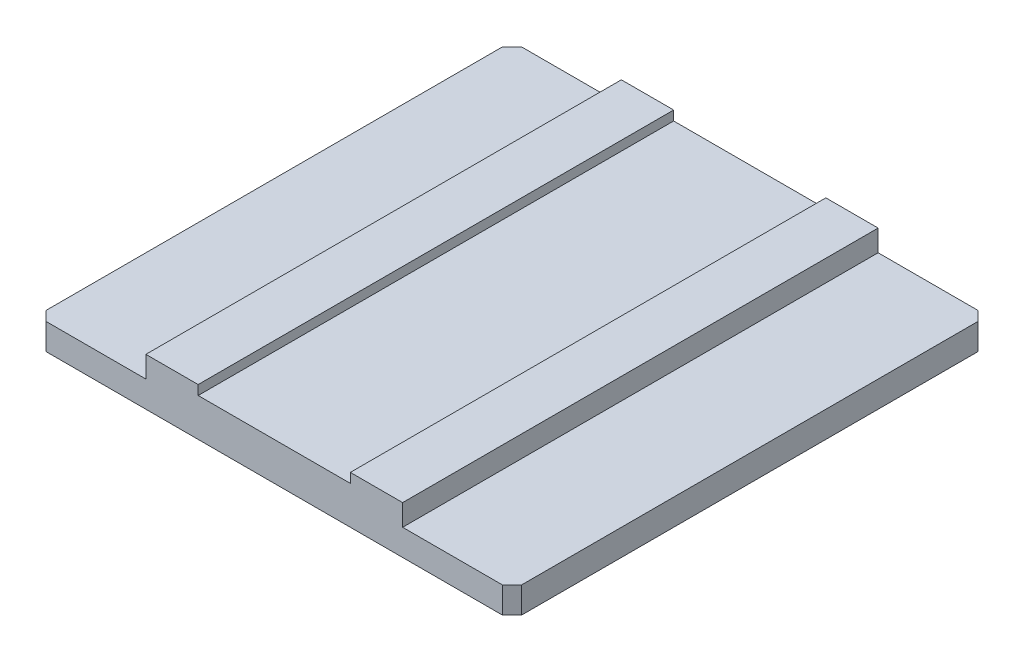
from build123d import *

# Parameters (mm, degrees)
BOSS_EXTRUDE1_DEPTH = 100
CHAMFER1_SIZE       = 2


with BuildPart() as part:
    # Sketch2 → Boss-Extrude1 (new body)
    with BuildSketch(Plane.XY):
        Polygon((-50, 0), (50, 0), (50, 5.5), (27, 5.5), (27, 10), (16, 10), (16, 8), (-16, 8), (-16, 10), (-27, 10), (-27, 5.5), (-50, 5.5), align=None)
    extrude(amount=BOSS_EXTRUDE1_DEPTH)

    # Chamfer1
    chamfer1_edges = [part.edges().sort_by_distance(p)[0] for p in [
        (-50, 2.75, 0),
        (50, 2.75, 0),
        (-50, 2.75, 100),
        (50, 2.75, 100),
    ]]
    chamfer(chamfer1_edges, length=CHAMFER1_SIZE)


solid = part.part
